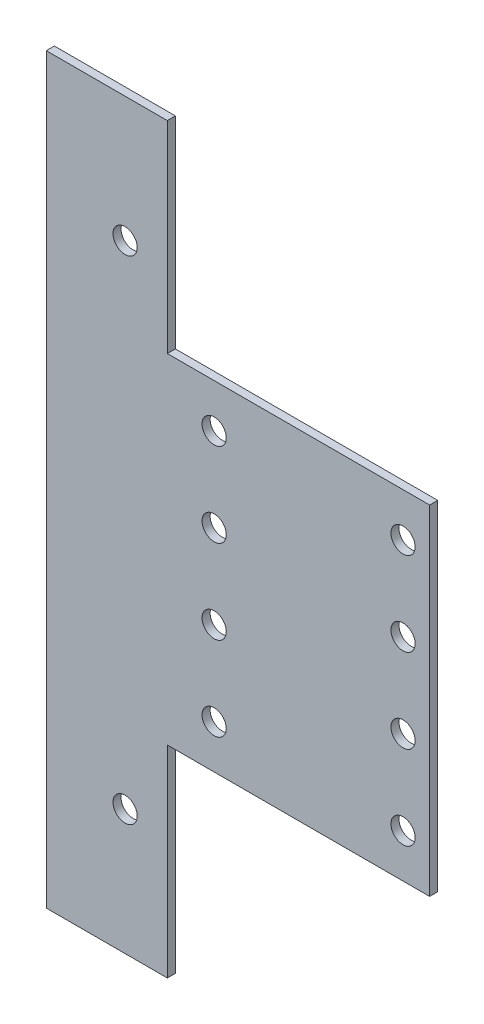
from build123d import *

# Parameters (mm, degrees)
SKETCH_1_R      = 1.5
EXTRUDE_1_DEPTH = 1


with BuildPart() as part:
    # Эскиз1 → Бобышка-Вытянуть1 (new body)
    with BuildSketch(Plane.XY):
        Polygon((-23.75, 46), (-23.75, -46), (-8.75, -46), (-8.75, -21), (23.75, -21), (23.75, 21), (-8.75, 21), (-8.75, 46), align=None)
        with Locations((-13.986702311, 30.5)):
            Circle(SKETCH_1_R, mode=Mode.SUBTRACT)
        with Locations((-13.986702311, -30.5)):
            Circle(SKETCH_1_R, mode=Mode.SUBTRACT)
        with Locations((-2.95, -15.6)):
            Circle(SKETCH_1_R, mode=Mode.SUBTRACT)
        with Locations((-2.95, -5.2)):
            Circle(SKETCH_1_R, mode=Mode.SUBTRACT)
        with Locations((-2.95, 5.2)):
            Circle(SKETCH_1_R, mode=Mode.SUBTRACT)
        with Locations((-2.95, 15.6)):
            Circle(SKETCH_1_R, mode=Mode.SUBTRACT)
        with Locations((20.45, 15.6)):
            Circle(SKETCH_1_R, mode=Mode.SUBTRACT)
        with Locations((20.45, 5.2)):
            Circle(SKETCH_1_R, mode=Mode.SUBTRACT)
        with Locations((20.45, -5.2)):
            Circle(SKETCH_1_R, mode=Mode.SUBTRACT)
        with Locations((20.45, -15.6)):
            Circle(SKETCH_1_R, mode=Mode.SUBTRACT)
    extrude(amount=EXTRUDE_1_DEPTH)


solid = part.part
